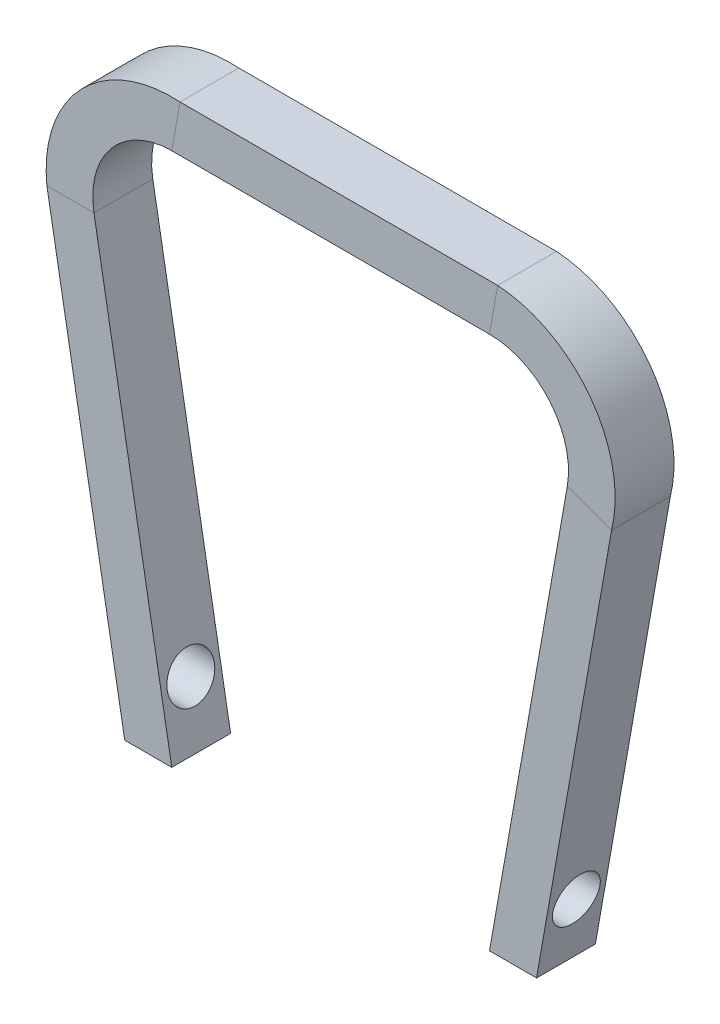
from build123d import *

# Parameters (mm, degrees)
SKETCH2_W          = 10.16
SKETCH2_H          = 12.7
SKETCH3_W          = 10.16
SKETCH3_H          = 12.7
CUT_EXTRUDE1_DEPTH = 5.08
SKETCH5_R          = 5.092900553
CUT_EXTRUDE2_DEPTH = 127


with BuildPart() as part:
    # Sweep2: sweep along a path in Sketch1
    with BuildLine(Plane.XY) as sweep2_path:
        Line((0, 0), (-16.795144912, 95.25))
        ThreePointArc((-16.795144912, 95.25), (-13.064303558, 109.17368949), (0, 115.265674288))
        Line((0, 115.265674288), (68.58, 115.265674288))
        ThreePointArc((68.58, 115.265674288), (81.644303558, 109.17368949), (85.375144912, 95.25))
        Line((85.375144912, 95.25), (68.58, 0))
    # Sketch2 → Sweep2 (sweep)
    with BuildSketch(Plane(origin=(0, 0, 0), x_dir=(1, 0, 0), z_dir=(0, 1, 0))):
        with Locations((-5.08, 0)):
            Rectangle(SKETCH2_W, SKETCH2_H)
    sweep(path=sweep2_path.line)

    # Sketch3 → Cut-Extrude1 (cut)
    with BuildSketch(Plane(origin=(0, 0, 0), x_dir=(1, 0, 0), z_dir=(0, 1, 0))):
        with Locations((73.66, 0)):
            Rectangle(SKETCH3_W, SKETCH3_H)
    extrude(amount=-CUT_EXTRUDE1_DEPTH, mode=Mode.SUBTRACT)

    # Sketch5 → Cut-Extrude2 (cut, symmetric)
    with BuildSketch(Plane(origin=(0, 0, 0), x_dir=(0, 0, -1), z_dir=(1, 0, 0))):
        with Locations(Location((0, 12.7, 0), (0, 0, 270))):
            Circle(SKETCH5_R)
    extrude(amount=CUT_EXTRUDE2_DEPTH, both=True, mode=Mode.SUBTRACT)


solid = part.part
